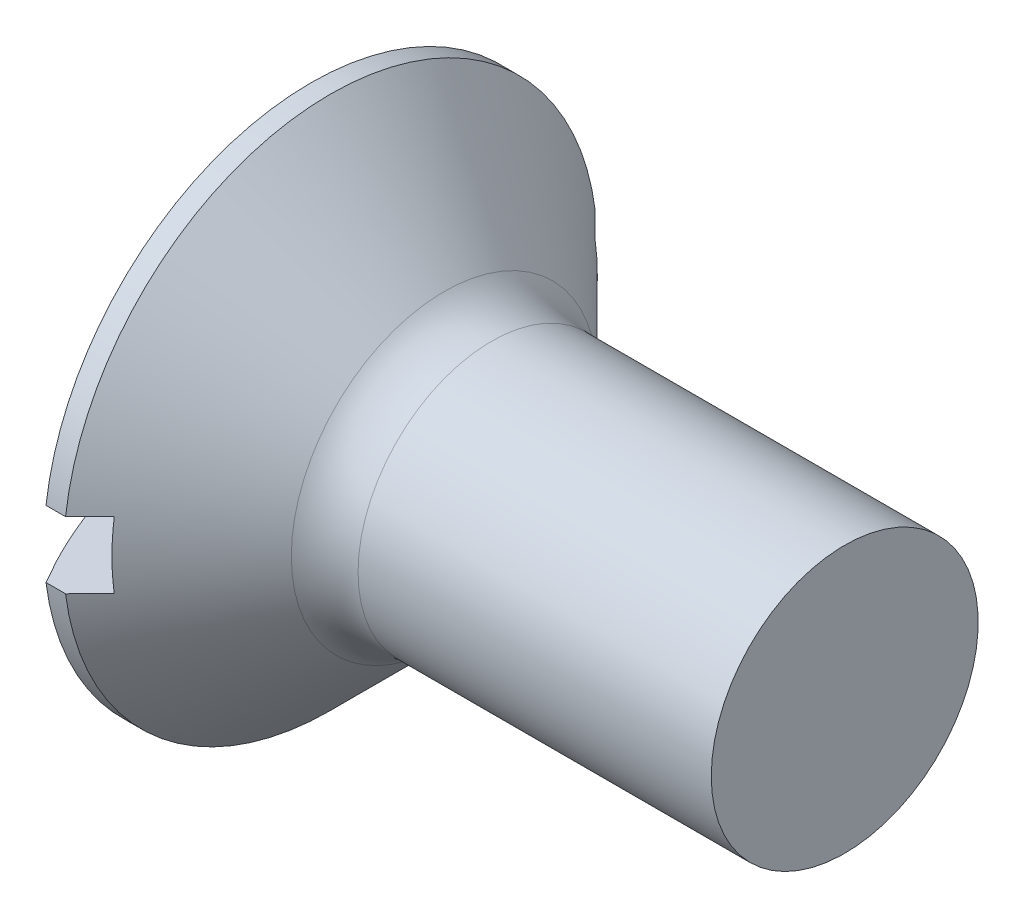
from build123d import *

# Parameters (mm, degrees)
SLOT_DEPTH      = 27.795282152
SLOT_DEPTH_BACK = 27.795282152
SKE_SLOT_W      = 4.4
SKE_SLOT_H      = 2.5


with BuildPart() as part:
    # Ske-Screw → Base (revolve)
    with BuildSketch(Plane.XY, mode=Mode.PRIVATE) as base_sk:
        with BuildLine():
            Line((2.759330957, 10), (3.491564004, 10))
            Line((3.491564004, 10), (7.759330957, 5.732233047))
            ThreePointArc((7.759330957, 5.732233047), (8.570389329, 5.190301169), (9.52709791, 5))
            Line((9.52709791, 5), (22.759330957, 5))
            Line((22.759330957, 5), (22.759330957, 0))
            Line((22.759330957, 0), (2.759330957, 0))
            Line((2.759330957, 0), (0, 0))
            ThreePointArc((0, 0), (0.70248625, 5.186856161), (2.759330957, 10))
        make_face()
    revolve(base_sk.sketch.rotate(Axis((-1.349906986, 0, 0), (1, 0, 0)), 90), axis=Axis((-1.349906986, 0, 0), (1, 0, 0)))

    # Ske-Slot → Slot (cut, two sides: drawn at the far end of the back side and taken through both)
    with BuildSketch(Plane.XY.offset(-SLOT_DEPTH_BACK)):
        with Locations((2.2, 0)):
            Rectangle(SKE_SLOT_W, SKE_SLOT_H)
    extrude(amount=SLOT_DEPTH + SLOT_DEPTH_BACK, mode=Mode.SUBTRACT)


solid = part.part
